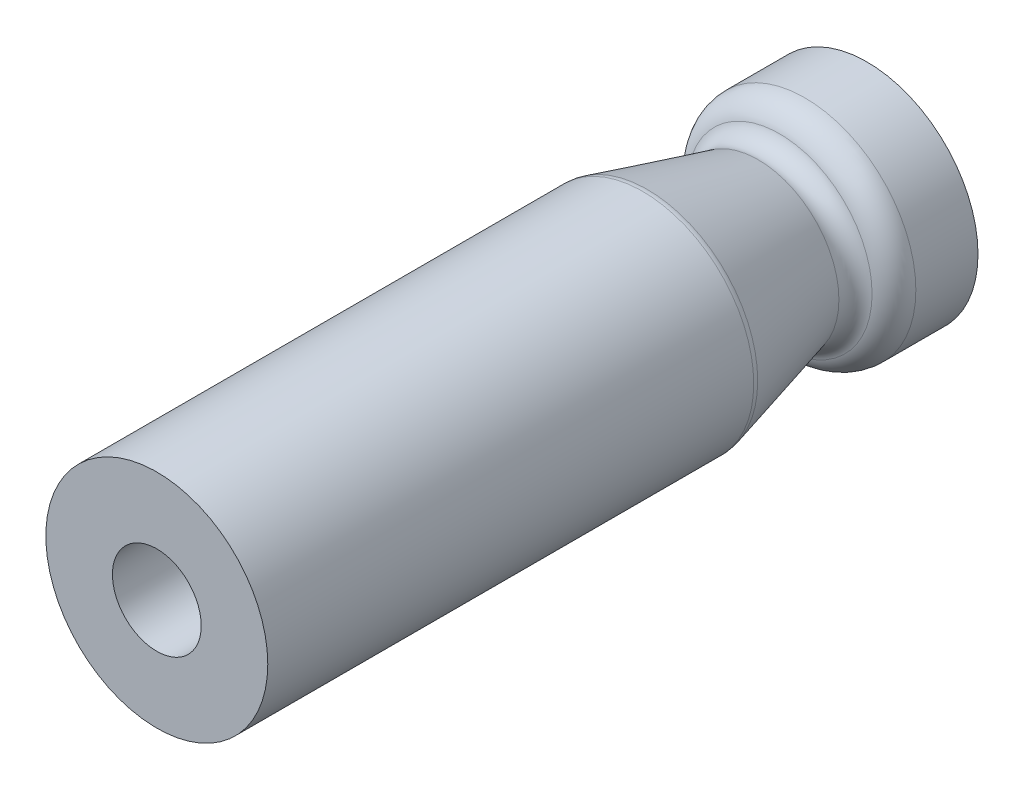
from build123d import *

# Parameters (mm, degrees)
SKETCH_1_R      = 12.5
SKETCH_1_R_2    = 5
EXTRUDE_1_DEPTH = 80
FILLET_1_R      = 3
FILLET_2_R      = 2
FILLET_3_R      = 2


with BuildPart() as part:
    # Эскиз1 → Вытянуть-Тонкостенный1 (new body)
    with BuildSketch(Plane.XY):
        Circle(SKETCH_1_R)
        Circle(SKETCH_1_R_2, mode=Mode.SUBTRACT)
    extrude(amount=EXTRUDE_1_DEPTH)

    # Эскиз2 → Вырез-Повернуть1 (revolve, cut)
    with BuildSketch(Plane(origin=(0, 0, 0), x_dir=(1, 0, 0), z_dir=(0, 1, 0)), mode=Mode.PRIVATE) as cut_revolve_1_sk:
        Polygon((12.5, -10), (8.5, -10), (12.5, -25), align=None)
    revolve(cut_revolve_1_sk.sketch.rotate(Axis((0, 0, -6.599641281), (0, 0, 1)), 180), axis=Axis((0, 0, -6.599641281), (0, 0, 1)), mode=Mode.SUBTRACT)

    # Скругление1
    fillet_1_edges = [part.edges().sort_by_distance(p)[0] for p in [
        (-12.5, 0, 10),
    ]]
    fillet(fillet_1_edges, radius=FILLET_1_R)

    # Скругление2
    fillet_2_edges = [part.edges().sort_by_distance(p)[0] for p in [
        (8.5, 0, 10),
    ]]
    fillet(fillet_2_edges, radius=FILLET_2_R)

    # Скругление3
    fillet_3_edges = [part.edges().sort_by_distance(p)[0] for p in [
        (0, -12.5, 25),
    ]]
    fillet(fillet_3_edges, radius=FILLET_3_R)


solid = part.part
